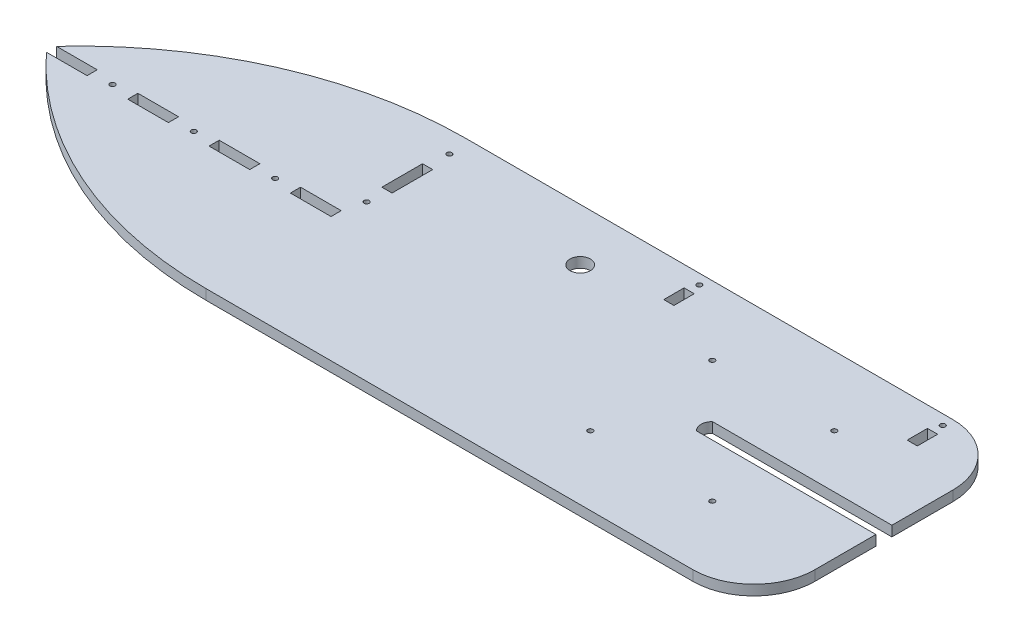
from build123d import *

# Parameters (mm, degrees)
SKETCH1_R           = 1.5875
SKETCH1_R_2         = 6.35
SKETCH1_W           = 25.4
SKETCH1_H           = 6.35
SKETCH1_W_2         = 6.35
SKETCH1_H_2         = 25.4
BOSS_EXTRUDE1_DEPTH = 6.35


with BuildPart() as part:
    # Sketch1 → Boss-Extrude1 (new body)
    with BuildSketch(Plane(origin=(0, 0, 0), x_dir=(1, 0, 0), z_dir=(0, 1, 0))):
        with BuildLine():
            Line((140.298116931, -30.240679996), (241.898116931, -30.240679996))
            Line((241.898116931, -30.240679996), (241.898116931, 7.859320004))
            ThreePointArc((241.898116931, 7.859320004), (230.738885294, 34.800088367), (203.798116931, 45.959320004))
            Line((203.798116931, 45.959320004), (-100.246301542, 45.959320004))
            ThreePointArc((-100.246301542, 45.959320004), (-197.330457857, 25.59371369), (-278.046301542, -32.069479996))
            Line((-278.046301542, -32.069479996), (-252.646301542, -32.069479996))
            Line((-252.646301542, -32.069479996), (-252.646301542, -38.419479996))
            Line((-252.646301542, -38.419479996), (-278.046301542, -38.419479996))
            ThreePointArc((-278.046301542, -38.419479996), (-197.330457857, -96.082673683), (-100.246301542, -116.448279996))
            Line((-100.246301542, -116.448279996), (203.798116931, -116.448279996))
            ThreePointArc((203.798116931, -116.448279996), (230.738885294, -105.28904836), (241.898116931, -78.348279996))
            Line((241.898116931, -78.348279996), (241.898116931, -40.248279996))
            Line((241.898116931, -40.248279996), (140.298116931, -40.248279996))
            Line((140.298116931, -40.248279996), (129.808602201, -40.248279996))
            ThreePointArc((129.808602201, -40.248279996), (127.703699758, -35.244479996), (129.808602201, -30.240679996))
            Line((129.808602201, -30.240679996), (140.298116931, -30.240679996))
        make_face()
        with Locations(Location((172.803698458, -73.344479996, 0), (0, 0, 270))):
            Circle(SKETCH1_R, mode=Mode.SUBTRACT)
        with Locations(Location((96.603698458, -73.344479996, 0), (0, 0, 270))):
            Circle(SKETCH1_R, mode=Mode.SUBTRACT)
        with Locations(Location((96.603698458, 2.855520004, 0), (0, 0, 270))):
            Circle(SKETCH1_R, mode=Mode.SUBTRACT)
        with Locations(Location((172.803698458, 2.855520004, 0), (0, 0, 270))):
            Circle(SKETCH1_R, mode=Mode.SUBTRACT)
        with Locations(Location((-138.346301542, -35.244479996, 0), (0, 0, 270))):
            Circle(SKETCH1_R, mode=Mode.SUBTRACT)
        with Locations(Location((-189.146301542, -35.244479996, 0), (0, 0, 270))):
            Circle(SKETCH1_R, mode=Mode.SUBTRACT)
        with Locations(Location((-239.946301542, -35.244479996, 0), (0, 0, 270))):
            Circle(SKETCH1_R, mode=Mode.SUBTRACT)
        with Locations(Location((-97.071301542, -19.369479996, 0), (0, 0, 270))):
            Circle(SKETCH1_R, mode=Mode.SUBTRACT)
        with Locations(Location((-97.071301542, 32.344920004, 0), (0, 0, 270))):
            Circle(SKETCH1_R, mode=Mode.SUBTRACT)
        with Locations(Location((3.692285597, 13.253970497, 0), (0, 0, 270))):
            Circle(SKETCH1_R_2, mode=Mode.SUBTRACT)
        with Locations(Location((203.798116931, 39.609320004, 0), (0, 0, 270))):
            Circle(SKETCH1_R, mode=Mode.SUBTRACT)
        with Locations(Location((51.775907694, 39.609320004, 0), (0, 0, 270))):
            Circle(SKETCH1_R, mode=Mode.SUBTRACT)
        with Locations((-112.946301542, -35.244479996)):
            Rectangle(SKETCH1_W, SKETCH1_H, mode=Mode.SUBTRACT)
        with Locations((-163.746301542, -35.244479996)):
            Rectangle(SKETCH1_W, SKETCH1_H, mode=Mode.SUBTRACT)
        with Locations((-214.546301542, -35.244479996)):
            Rectangle(SKETCH1_W, SKETCH1_H, mode=Mode.SUBTRACT)
        with Locations((-97.071301542, 6.030520004)):
            Rectangle(SKETCH1_W_2, SKETCH1_H_2, mode=Mode.SUBTRACT)
        Polygon((203.798116931, 33.259320004), (206.973116931, 33.259320004), (206.973116931, 20.559320004), (200.623116931, 20.559320004), (200.623116931, 33.259320004), align=None, mode=Mode.SUBTRACT)
        Polygon((51.775907694, 33.259320004), (54.950907694, 33.259320004), (54.950907694, 20.559320004), (48.600907694, 20.559320004), (48.600907694, 33.259320004), align=None, mode=Mode.SUBTRACT)
    extrude(amount=BOSS_EXTRUDE1_DEPTH)


solid = part.part
